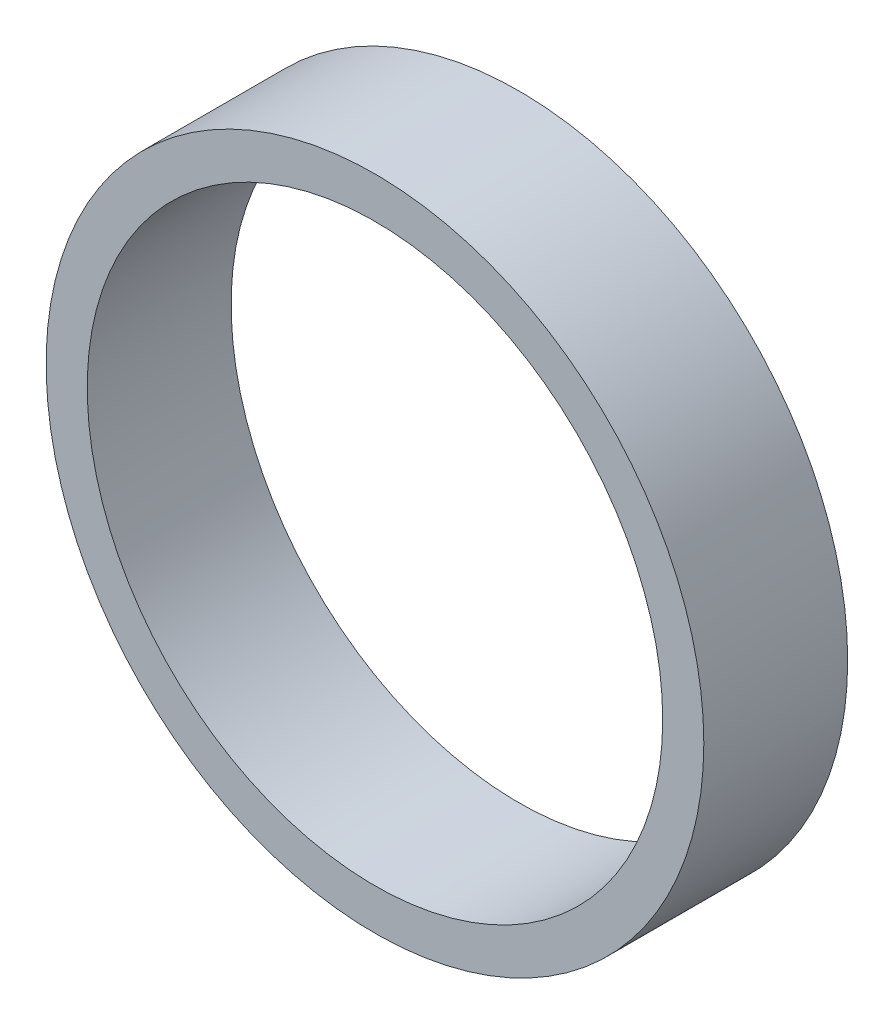
from build123d import *

# Parameters (mm, degrees)
SKETCH1_R           = 50.8
SKETCH1_R_2         = 44.45
BOSS_EXTRUDE1_DEPTH = 11.1125


with BuildPart() as part:
    # Sketch1 → Boss-Extrude1 (new, symmetric)
    with BuildSketch(Plane.XY):
        Circle(SKETCH1_R)
        Circle(SKETCH1_R_2, mode=Mode.SUBTRACT)
    extrude(amount=BOSS_EXTRUDE1_DEPTH, both=True)


solid = part.part
